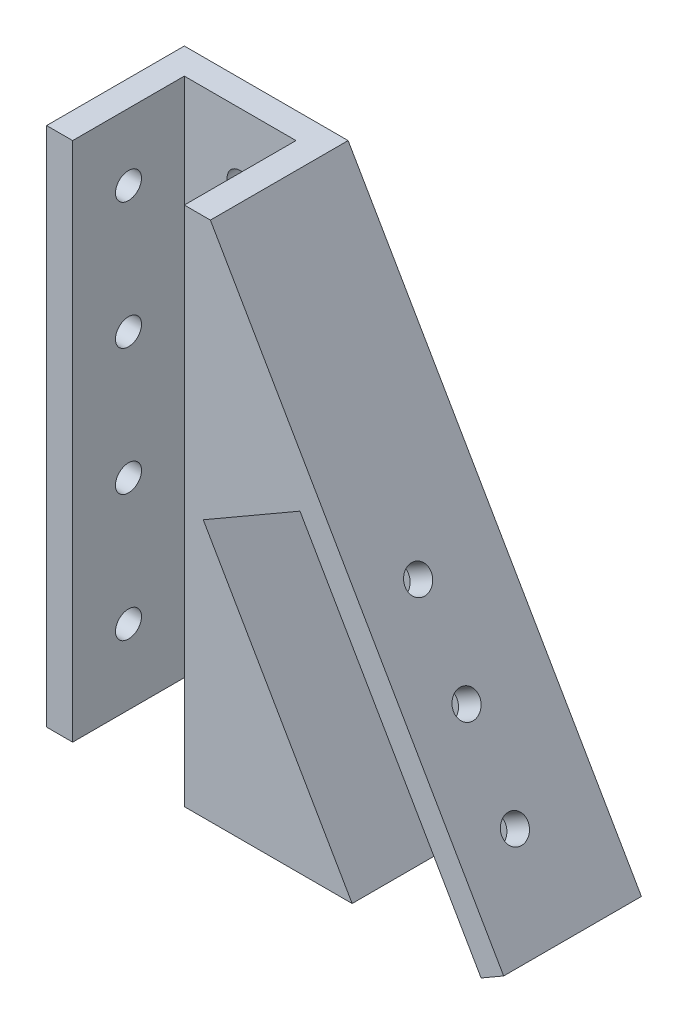
from build123d import *

# Parameters (mm, degrees)
BOSS_EXTRUDE1_DEPTH = 18.5
SKETCH2_W           = 15
SKETCH2_H           = 69.980762113
CUT_EXTRUDE1_DEPTH  = 15
SKETCH3_R           = 1.75
CUT_EXTRUDE2_DEPTH  = 3.5
SKETCH4_R           = 1.75
CUT_EXTRUDE3_DEPTH  = 4
SKETCH5_R           = 1.75
CUT_EXTRUDE4_DEPTH  = 4
CUT_EXTRUDE5_DEPTH  = 19


with BuildPart() as part:
    # Sketch1 → Boss-Extrude1 (new body)
    with BuildSketch(Plane.XY):
        Polygon((7.85498998, 37.469557102), (48.258401824, -32.511205011), (7.85498998, -32.511205011), (-14.14501002, -32.511205011), (-14.14501002, 37.469557102), align=None)
    extrude(amount=BOSS_EXTRUDE1_DEPTH)

    # Sketch2 → Cut-Extrude1 (cut)
    with BuildSketch(Plane.XY.offset(18.5)):
        with Locations((-3.14501002, 2.479176046)):
            Rectangle(SKETCH2_W, SKETCH2_H)
        Polygon((44.21694994, -32.511205011), (19.886822921, 9.62981114), (6.896441864, 2.12981114), (26.896441864, -32.511205011), align=None)
    extrude(amount=-CUT_EXTRUDE1_DEPTH, mode=Mode.SUBTRACT)

    # Sketch3 → Cut-Extrude2 (cut)
    with BuildSketch(Plane(origin=(22.116036645, 12.76869971, 0), x_dir=(0, 0, -1), z_dir=(0.8660254037844378, 0.5000000000000016, 0))):
        with Locations(Location((-11, -38.284730359, 0), (0, 0, 90))):
            Circle(SKETCH3_R)
        with Locations(Location((-11, -25.284730359, 0), (0, 0, 90))):
            Circle(SKETCH3_R)
        with Locations(Location((-11, -12.284730359, 0), (0, 0, 90))):
            Circle(SKETCH3_R)
    extrude(amount=-CUT_EXTRUDE2_DEPTH, mode=Mode.SUBTRACT)

    # Sketch4 → Cut-Extrude3 (cut)
    with BuildSketch(Plane(origin=(0, 0, 0), x_dir=(-1, 0, 0), z_dir=(0, 0, -1))):
        with Locations((-30.556695902, -23.850950973)):
            Circle(SKETCH4_R)
        with Locations((-24.056695902, -12.592620724)):
            Circle(SKETCH4_R)
        with Locations((-17.556695902, -1.334290475)):
            Circle(SKETCH4_R)
        with Locations((3.14501002, -5.511205011)):
            Circle(SKETCH4_R)
        with Locations((3.14501002, 11.488794989)):
            Circle(SKETCH4_R)
        with Locations((3.14501002, 28.488794989)):
            Circle(SKETCH4_R)
        with Locations((3.14501002, -22.511205011)):
            Circle(SKETCH4_R)
    extrude(amount=-CUT_EXTRUDE3_DEPTH, mode=Mode.SUBTRACT)

    # Sketch5 → Cut-Extrude4 (cut)
    with BuildSketch(Plane.ZY.offset(14.14501002)):
        with Locations(Location((11, -22.511205011, 0), (0, 0, 270))):
            Circle(SKETCH5_R)
        with Locations(Location((11, -5.511205011, 0), (0, 0, 270))):
            Circle(SKETCH5_R)
        with Locations(Location((11, 11.488794989, 0), (0, 0, 270))):
            Circle(SKETCH5_R)
        with Locations(Location((11, 28.488794989, 0), (0, 0, 270))):
            Circle(SKETCH5_R)
    extrude(amount=-CUT_EXTRUDE4_DEPTH, mode=Mode.SUBTRACT)

    # Sketch6 → Cut-Extrude5 (cut)
    with BuildSketch(Plane.XY.offset(18.5)):
        Polygon((44.21694994, -32.511205011), (47.248038853, -30.761205011), (48.258401824, -32.511205011), align=None)
    extrude(amount=-CUT_EXTRUDE5_DEPTH, mode=Mode.SUBTRACT)


solid = part.part
